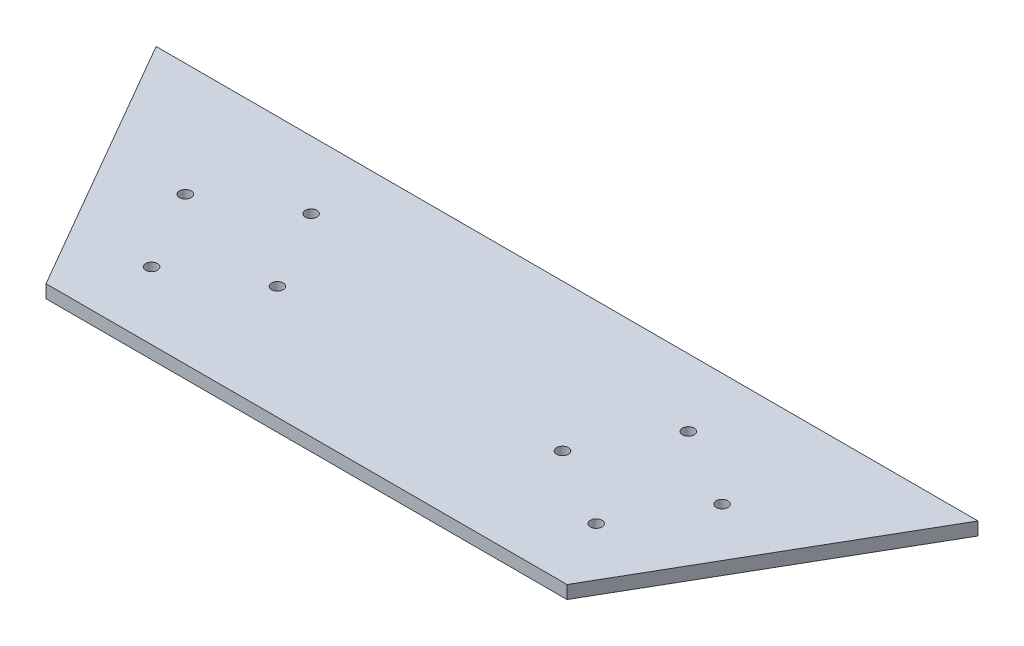
from build123d import *

# Parameters (mm, degrees)
BOSS_EXTRUDE1_DEPTH  = 10
M8_CLEARANCE_HOLE4_D = 9
M8_CLEARANCE_HOLE5_D = 9
CIRPATTERN1_COUNT    = 4
CIRPATTERN2_COUNT    = 4


with BuildPart() as part:
    # Sketch1 → Boss-Extrude1 (new body)
    with BuildSketch(Plane(origin=(0, 0, 0), x_dir=(1, 0, 0), z_dir=(0, 1, 0))):
        Polygon((-200, 0), (200, 0), (315.470053838, 200), (-315.470053838, 200), align=None)
    extrude(amount=BOSS_EXTRUDE1_DEPTH)

    # M8 Clearance Hole4 (through all)
    with Locations(Plane(origin=(0, 10, 0), x_dir=(1, 0, 0), z_dir=(0, 1, 0))):
        with Locations((-170.675979174, 51.703708686)):
            m8_clearance_hole4 = Hole(M8_CLEARANCE_HOLE4_D / 2)

    # M8 Clearance Hole5 (through all)
    with Locations(Plane(origin=(0, 10, 0), x_dir=(1, 0, 0), z_dir=(0, 1, 0))):
        with Locations((170.675979174, 51.703708686)):
            m8_clearance_hole5 = Hole(M8_CLEARANCE_HOLE5_D / 2)

    # CirPattern1: M8 Clearance Hole5 ×4 about axis
    cirpattern1_axis = Axis((157.735026919, 10, -100), (0, 1, 0))
    for i in range(1, CIRPATTERN1_COUNT):
        add(m8_clearance_hole5.rotate(cirpattern1_axis, i * 360 / CIRPATTERN1_COUNT), mode=Mode.SUBTRACT)

    # CirPattern2: M8 Clearance Hole4 ×4 about axis
    cirpattern2_axis = Axis((-157.735026919, 10, -100), (0, 1, 0))
    for i in range(1, CIRPATTERN2_COUNT):
        add(m8_clearance_hole4.rotate(cirpattern2_axis, i * 360 / CIRPATTERN2_COUNT), mode=Mode.SUBTRACT)


solid = part.part
